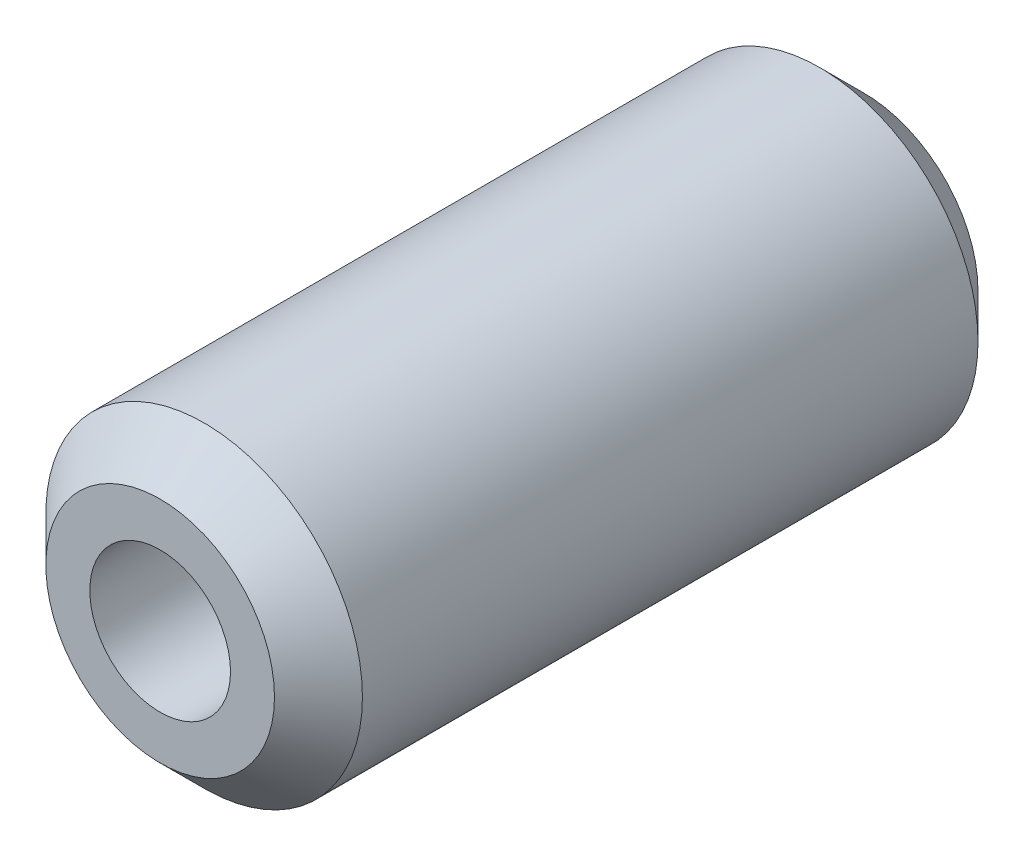
from build123d import *

# Parameters (mm, degrees)
SKETCH1_R           = 9
SKETCH1_R_2         = 4
BOSS_EXTRUDE1_DEPTH = 20
CHAMFER1_SIZE       = 2.5


with BuildPart() as part:
    # Sketch1 → Boss-Extrude1 (new, symmetric)
    with BuildSketch(Plane.XY):
        Circle(SKETCH1_R)
        Circle(SKETCH1_R_2, mode=Mode.SUBTRACT)
    extrude(amount=BOSS_EXTRUDE1_DEPTH, both=True)

    # Chamfer1
    chamfer1_edges = [part.edges().sort_by_distance(p)[0] for p in [
        (-9, 0, -20),
        (-9, 0, 20),
    ]]
    chamfer(chamfer1_edges, length=CHAMFER1_SIZE)


solid = part.part
